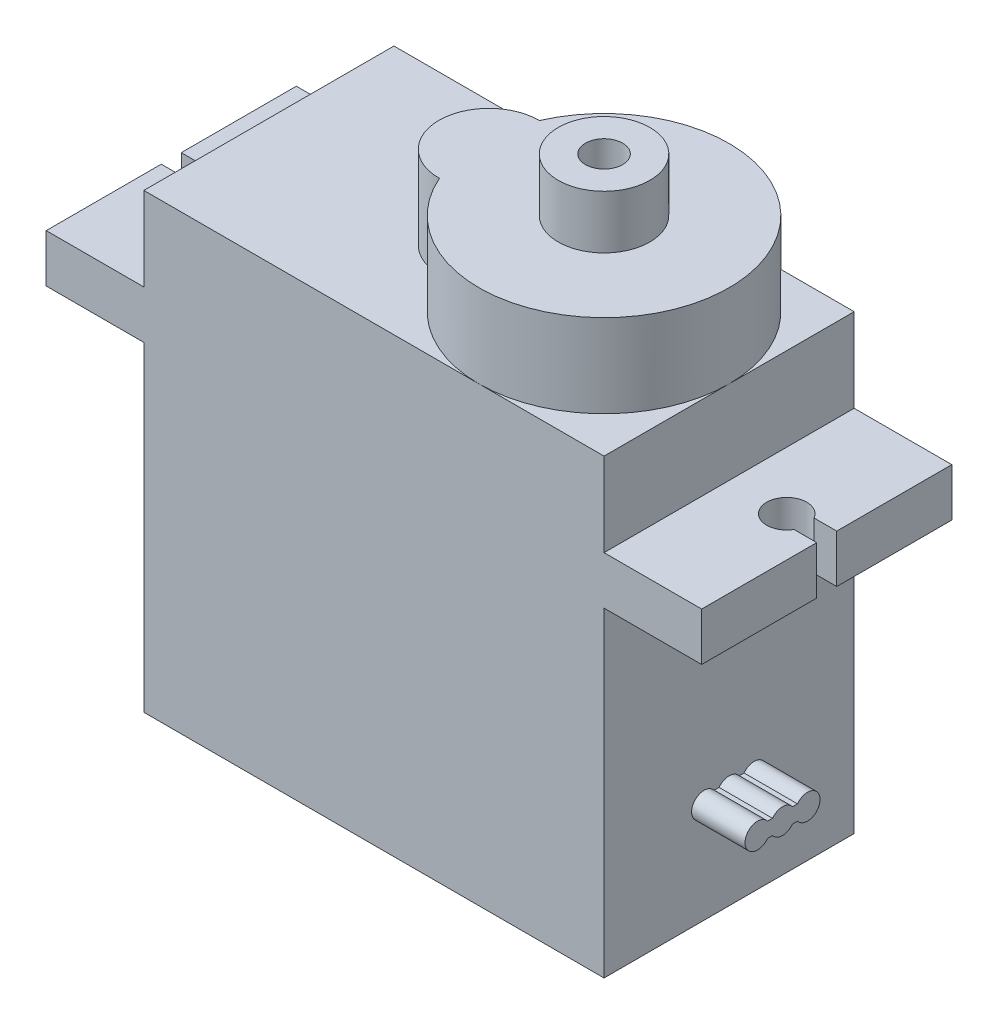
from build123d import *

# Parameters (mm, degrees)
SKETCH1_W           = 23
SKETCH1_H           = 12.5
BOSS_EXTRUDE1_DEPTH = 22.59
SKETCH2_R           = 6.25
BOSS_EXTRUDE2_DEPTH = 4.16
SKETCH3_R           = 2.5
BOSS_EXTRUDE3_DEPTH = 4.16
SKETCH6_R           = 2.29
SKETCH6_R_2         = 0.93
BOSS_EXTRUDE5_DEPTH = 2.67
SKETCH4_W           = 12.5
SKETCH4_H           = 2.4
BOSS_EXTRUDE4_DEPTH = 4.88
CUT_EXTRUDE1_DEPTH  = 36.671732506
SKETCH7_R           = 0.625
SKETCH7_W           = 1.497675386
SKETCH7_H           = 0.746890466
BOSS_EXTRUDE7_DEPTH = 2.67


with BuildPart() as part:
    # Sketch1 → Boss-Extrude1 (new body)
    with BuildSketch(Plane(origin=(0, 0, 0), x_dir=(1, 0, 0), z_dir=(0, 1, 0))):
        with Locations((11.5, 6.25)):
            Rectangle(SKETCH1_W, SKETCH1_H)
    extrude(amount=BOSS_EXTRUDE1_DEPTH)

    # Sketch2 → Boss-Extrude2 (add)
    with BuildSketch(Plane(origin=(0, 22.59, 0), x_dir=(1, 0, 0), z_dir=(0, 1, 0))):
        with Locations(Location((16.75, 6.25, 0), (0, 0, 270))):
            Circle(SKETCH2_R)
    extrude(amount=BOSS_EXTRUDE2_DEPTH)

    # Sketch3 → Boss-Extrude3 (add)
    with BuildSketch(Plane(origin=(0, 22.59, 0), x_dir=(1, 0, 0), z_dir=(0, 1, 0))):
        with Locations((11, 6.25)):
            Circle(SKETCH3_R)
    extrude(amount=BOSS_EXTRUDE3_DEPTH)

    # Sketch4 → Boss-Extrude4 (add)
    with BuildSketch(Plane(origin=(23, 0, 0), x_dir=(0, 0, -1), z_dir=(1, 0, 0))):
        with Locations((6.25, 17.21)):
            Rectangle(SKETCH4_W, SKETCH4_H)
    boss_extrude4 = extrude(amount=BOSS_EXTRUDE4_DEPTH)

    # Sketch5 → Cut-Extrude1 (cut, through all)
    with BuildSketch(Plane(origin=(0, 18.41, 0), x_dir=(1, 0, 0), z_dir=(0, 1, 0))):
        with BuildLine():
            Line((25.88, 5.75), (25.88, 6.75))
            Line((25.88, 6.75), (26.746025404, 6.75))
            ThreePointArc((26.746025404, 6.75), (24.88, 6.25), (26.746025404, 5.75))
            Line((26.746025404, 5.75), (25.88, 5.75))
        make_face()
        with BuildLine():
            Line((26.746025404, 6.75), (25.88, 6.75))
            Line((25.88, 6.75), (25.88, 5.75))
            Line((25.88, 5.75), (26.746025404, 5.75))
            ThreePointArc((26.746025404, 5.75), (26.845925826, 5.991180955), (26.88, 6.25))
            ThreePointArc((26.88, 6.25), (26.845925826, 6.508819045), (26.746025404, 6.75))
        make_face()
        with BuildLine():
            Line((27.88, 6.75), (26.746025404, 6.75))
            ThreePointArc((26.746025404, 6.75), (26.845925826, 6.508819045), (26.88, 6.25))
            ThreePointArc((26.88, 6.25), (26.845925826, 5.991180955), (26.746025404, 5.75))
            Line((26.746025404, 5.75), (27.88, 5.75))
            Line((27.88, 5.75), (27.88, 6.75))
        make_face()
    cut_extrude1 = extrude(amount=-CUT_EXTRUDE1_DEPTH, mode=Mode.SUBTRACT)

    # Mirror1: Boss-Extrude4, Cut-Extrude1 across plane
    add(boss_extrude4.mirror(Plane(origin=(11.5, 0, 0), x_dir=(0, 0, 1), z_dir=(1, 0, 0))))
    add(cut_extrude1.mirror(Plane(origin=(11.5, 0, 0), x_dir=(0, 0, 1), z_dir=(1, 0, 0))), mode=Mode.SUBTRACT)

    # Sketch7 → Boss-Extrude7 (add)
    with BuildSketch(Plane(origin=(23, 0, 0), x_dir=(0, 0, -1), z_dir=(1, 0, 0))):
        with Locations((7.5, 5)):
            Circle(SKETCH7_R)
        with Locations((6.25, 5)):
            Circle(SKETCH7_R)
        with Locations((5, 5)):
            Circle(SKETCH7_R)
        with Locations((6.25, 5)):
            Rectangle(SKETCH7_W, SKETCH7_H)
    extrude(amount=BOSS_EXTRUDE7_DEPTH)


with BuildPart() as body_2:
    # Sketch6 → Boss-Extrude5 (new body)
    with BuildSketch(Plane(origin=(0, 26.75, 0), x_dir=(1, 0, 0), z_dir=(0, 1, 0))):
        with Locations(Location((16.75, 6.25, 0), (0, 0, 90))):
            Circle(SKETCH6_R)
        with Locations(Location((16.75, 6.25, 0), (0, 0, 90))):
            Circle(SKETCH6_R_2, mode=Mode.SUBTRACT)
    extrude(amount=BOSS_EXTRUDE5_DEPTH)


solid = Compound([part.part, body_2.part])
